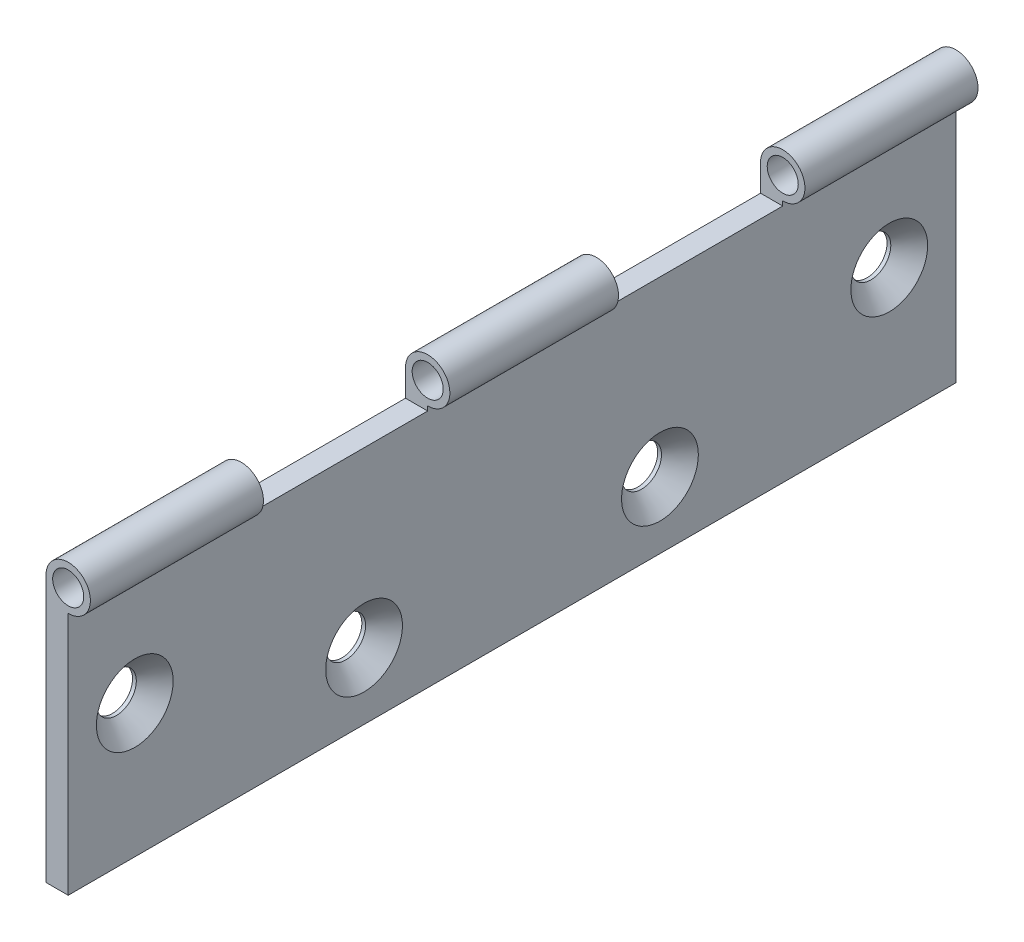
from build123d import *

# Parameters (mm, degrees)
SKETCH1_W                                      = 5
SKETCH1_H                                      = 60
EXTRUDE_THIN1_DEPTH                            = 100
SKETCH3_R                                      = 5
SKETCH13_R                                     = 3.5
CUT_EXTRUDE1_DEPTH                             = 211.535032714
CSK_FOR_M8_FLAT_HEAD_MACHINE_SCREW1_AT_2_COUNT = 2
CSK_FOR_M8_FLAT_HEAD_MACHINE_SCREW1_AT_2_PITCH = 53.800041305
F_2CUTS_DEPTH                                  = 120.373363863
F_2CUTS_DEPTH_BACK                             = 120.373363863
SKETCH23_W                                     = 42
SKETCH23_H                                     = 11


with BuildPart() as part:
    # Sketch1 → Extrude-Thin1 (new, symmetric)
    with BuildSketch(Plane.XY):
        with Locations((2.5, 30)):
            Rectangle(SKETCH1_W, SKETCH1_H)
    extrude(amount=EXTRUDE_THIN1_DEPTH, both=True)

    # Sweep5: sweep along a curve in space
    with BuildLine() as sweep5_path:
        Line((5, 60, 100), (5, 60, -100))
    # Sketch3 → Sweep5 (sweep)
    with BuildSketch(Plane.XY.offset(100)):
        with Locations((5, 60)):
            Circle(SKETCH3_R)
    sweep(path=sweep5_path.line)

    # Sketch13 → Cut-Extrude1 (cut, through all)
    with BuildSketch(Plane.XY.offset(100)):
        with Locations((5, 60)):
            Circle(SKETCH13_R)
    extrude(amount=-CUT_EXTRUDE1_DEPTH, mode=Mode.SUBTRACT)

    # Sketch15 → CSK for M8 Flat Head Machine Screw1 (revolve, cut)
    with BuildSketch(Plane(origin=(5, 30, 85), x_dir=(0, 0, -1), z_dir=(0, 1, 0))):
        Polygon((0, 0), (0, 5), (4.5, 5), (4.5, 4.15), (8.65, 0), align=None)
    csk_for_m8_flat_head_machine_screw1 = revolve(axis=Axis((11.35, 30, 85), (-1, 0, 0)), mode=Mode.SUBTRACT)

    # CSK for M8 Flat Head Machine Screw1 at 2: CSK for M8 Flat Head Machine Screw1 ×2
    with Locations(*[Vector(0, -0.2788101948639555, -0.9603462267536241) * (i * CSK_FOR_M8_FLAT_HEAD_MACHINE_SCREW1_AT_2_PITCH) for i in range(1, CSK_FOR_M8_FLAT_HEAD_MACHINE_SCREW1_AT_2_COUNT)]):
        add(csk_for_m8_flat_head_machine_screw1, mode=Mode.SUBTRACT)

    # Mirror1: CSK for M8 Flat Head Machine Screw1 across plane
    add(csk_for_m8_flat_head_machine_screw1.mirror(Plane.XY), mode=Mode.SUBTRACT)

    # Mirror1 copy 1 sketch → Mirror1 copy 1 (revolve, cut)
    with BuildSketch(Plane(origin=(5, 15, -33.333333333), x_dir=(0, 0, 1), z_dir=(0, 1, 0))):
        Polygon((0, 0), (0, -5), (4.5, -5), (4.5, -4.15), (8.65, 0), align=None)
    revolve(axis=Axis((11.35, 15, -33.333333333), (1, 0, 0)), mode=Mode.SUBTRACT)

    # Sketch23 → 2Cuts (cut, two sides: drawn at the far end of the back side and taken through both)
    with BuildSketch(Plane(origin=(5, 0, 0), x_dir=(0, 0, -1), z_dir=(1, 0, 0)).offset(-F_2CUTS_DEPTH_BACK)):
        with Locations((-40, 59.5)):
            Rectangle(SKETCH23_W, SKETCH23_H)
        with Locations((40, 59.5)):
            Rectangle(SKETCH23_W, SKETCH23_H)
    extrude(amount=F_2CUTS_DEPTH + F_2CUTS_DEPTH_BACK, mode=Mode.SUBTRACT)


solid = part.part
